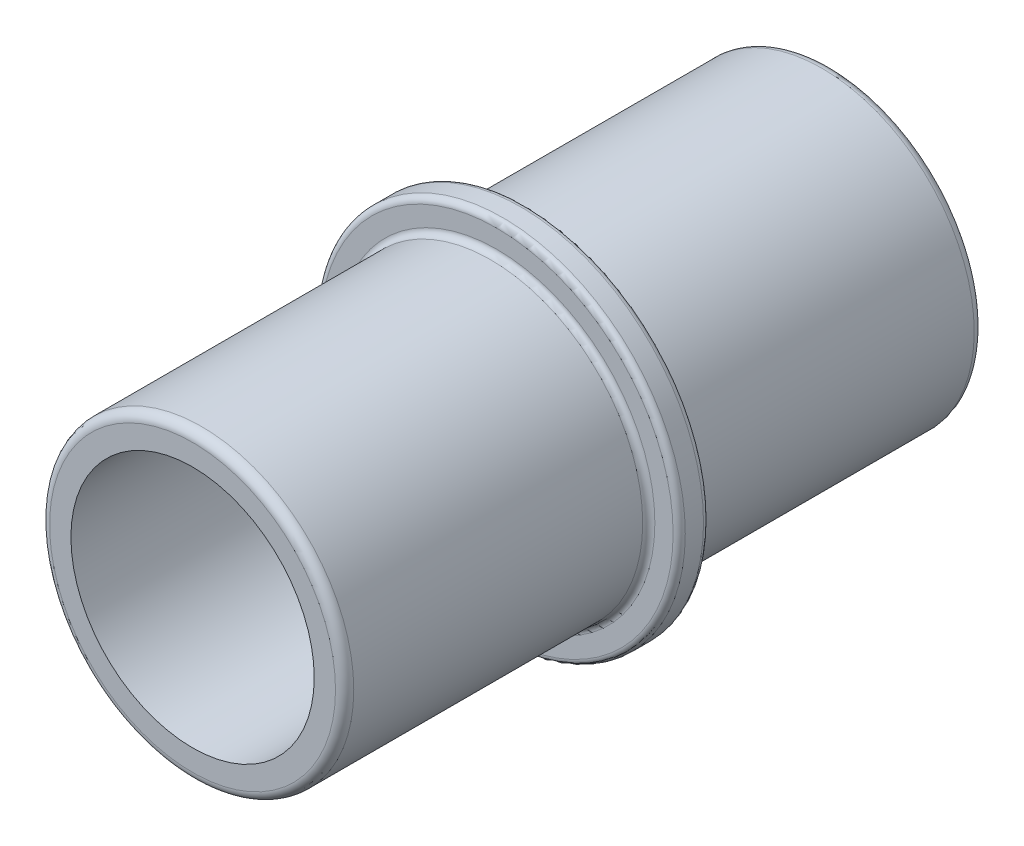
from build123d import *

# Parameters (mm, degrees)
SKETCH1_R           = 0.6
BOSS_EXTRUDE1_DEPTH = 0.1
SKETCH2_R           = 0.5
BOSS_EXTRUDE2_DEPTH = 1
BOSS_EXTRUDE3_START = 1
SKETCH4_R           = 0.5
BOSS_EXTRUDE3_DEPTH = 1
FILLET1_R           = 0.02
FILLET2_R           = 0.02
FILLET3_R           = 0.02
FILLET4_R           = 0.02
FILLET5_R           = 0.03
FILLET6_R           = 0.03
SKETCH5_R           = 0.4
CUT_EXTRUDE1_DEPTH  = 2.1


with BuildPart() as part:
    # Sketch1 → Boss-Extrude1 (new body)
    with BuildSketch(Plane.XY):
        Circle(SKETCH1_R)
    extrude(amount=BOSS_EXTRUDE1_DEPTH)

    # Sketch2 → Boss-Extrude2 (add)
    with BuildSketch(Plane.XY.offset(0.1)):
        Circle(SKETCH2_R)
    extrude(amount=BOSS_EXTRUDE2_DEPTH)

    # Sketch4 → Boss-Extrude3 (add)
    with BuildSketch(Plane(origin=(0, 0, 0), x_dir=(-1, 0, 0), z_dir=(0, 0, -1)).offset(BOSS_EXTRUDE3_START)):
        with Locations(Location((0, 0, 0), (0, 0, 180))):
            Circle(SKETCH4_R)
    extrude(amount=-BOSS_EXTRUDE3_DEPTH)

    # Fillet1
    fillet1_edges = [part.edges().sort_by_distance(p)[0] for p in [
        (-0.6, 0, 0),
    ]]
    fillet(fillet1_edges, radius=FILLET1_R)

    # Fillet2
    fillet2_edges = [part.edges().sort_by_distance(p)[0] for p in [
        (-0.6, 0, 0.1),
    ]]
    fillet(fillet2_edges, radius=FILLET2_R)

    # Fillet3
    fillet3_edges = [part.edges().sort_by_distance(p)[0] for p in [
        (-0.5, 0, 0.1),
    ]]
    fillet(fillet3_edges, radius=FILLET3_R)

    # Fillet4
    fillet4_edges = [part.edges().sort_by_distance(p)[0] for p in [
        (-0.5, 0, 0),
    ]]
    fillet(fillet4_edges, radius=FILLET4_R)

    # Fillet5
    fillet5_edges = [part.edges().sort_by_distance(p)[0] for p in [
        (-0.5, 0, 1.1),
    ]]
    fillet(fillet5_edges, radius=FILLET5_R)

    # Fillet6
    fillet6_edges = [part.edges().sort_by_distance(p)[0] for p in [
        (-0.5, 0, -1),
    ]]
    fillet(fillet6_edges, radius=FILLET6_R)

    # Sketch5 → Cut-Extrude1 (cut)
    with BuildSketch(Plane.XY.offset(1.1)):
        Circle(SKETCH5_R)
    extrude(amount=-CUT_EXTRUDE1_DEPTH, mode=Mode.SUBTRACT)


solid = part.part
